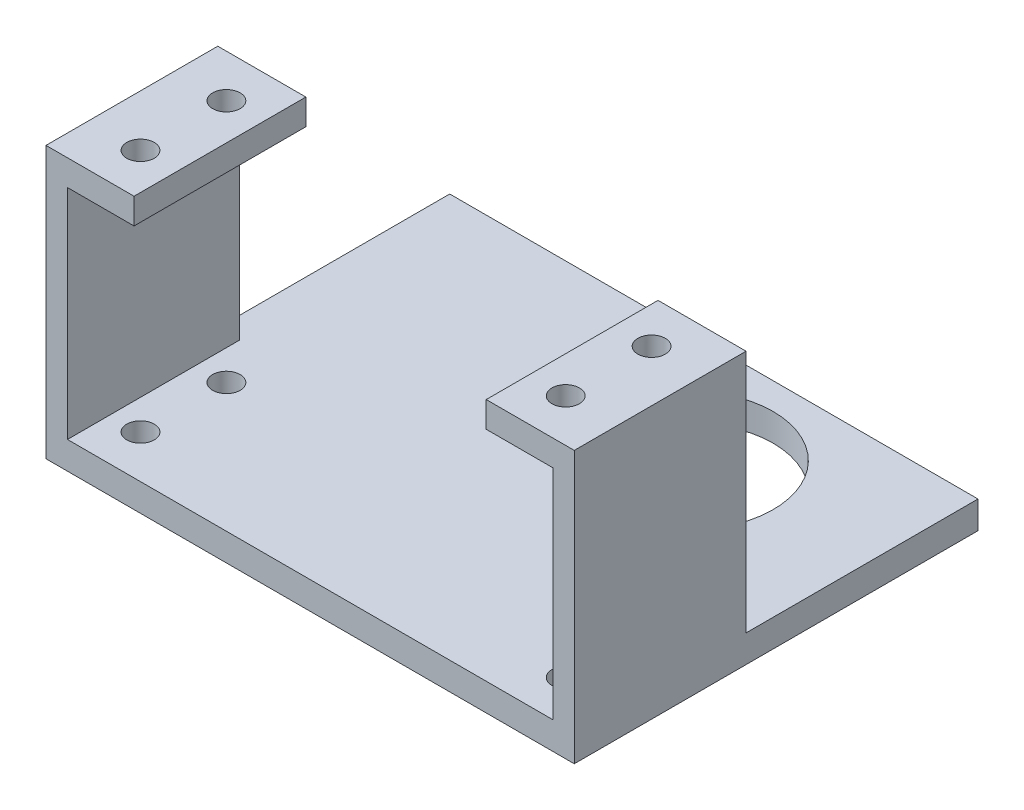
from build123d import *

# Parameters (mm, degrees)
PLATE_SKETCH_W       = 61.5
PLATE_SKETCH_H       = 47
PLATE_DEPTH          = 3.2
POSTS_DEPTH          = 20
SERVO_HOLES_SKETCH_R = 1.6
SERVO_HOLES_DEPTH    = 53.1
PANEL_HOLE_SKETCH_R  = 9.9
PANEL_HOLE_DEPTH     = 18.2


with BuildPart() as part:
    # Plate Sketch → Plate (new body)
    with BuildSketch(Plane(origin=(0, 14, 0), x_dir=(1, 0, 0), z_dir=(0, 1, 0))):
        with Locations((-10, -10.5)):
            Rectangle(PLATE_SKETCH_W, PLATE_SKETCH_H)
    extrude(amount=PLATE_DEPTH)

    # Posts Sketch → Posts (add)
    with BuildSketch(Plane.XY.offset(14)):
        Polygon((-40.75, 17.2), (-38.25, 17.2), (-38.25, 42.6), (-30.5, 42.6), (-30.5, 45.6), (-40.75, 45.6), align=None)
        Polygon((20.75, 17.2), (18.25, 17.2), (18.25, 42.6), (10.5, 42.6), (10.5, 45.6), (20.75, 45.6), align=None)
    extrude(amount=POSTS_DEPTH)

    # Servo Holes Sketch → Servo Holes (cut, symmetric)
    with BuildSketch(Plane(origin=(0, 0, 0), x_dir=(1, 0, 0), z_dir=(0, 1, 0))):
        with Locations((-34.75, -19)):
            Circle(SERVO_HOLES_SKETCH_R)
        with Locations((-34.75, -29)):
            Circle(SERVO_HOLES_SKETCH_R)
        with Locations((14.75, -19)):
            Circle(SERVO_HOLES_SKETCH_R)
        with Locations((14.75, -29)):
            Circle(SERVO_HOLES_SKETCH_R)
    extrude(amount=SERVO_HOLES_DEPTH, both=True, mode=Mode.SUBTRACT)

    # Panel Hole Sketch → Panel Hole (cut, symmetric)
    with BuildSketch(Plane(origin=(0, 0, 0), x_dir=(1, 0, 0), z_dir=(0, 1, 0))):
        Circle(PANEL_HOLE_SKETCH_R)
    extrude(amount=PANEL_HOLE_DEPTH, both=True, mode=Mode.SUBTRACT)


solid = part.part
